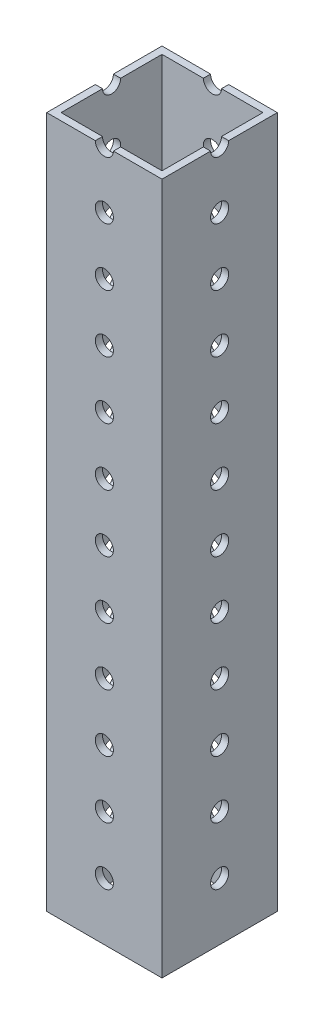
from build123d import *

# Parameters (mm, degrees)
SKETCH1_W                   = 25.4
SKETCH1_H                   = 25.4
SKETCH1_W_2                 = 22.225
SKETCH1_H_2                 = 22.225
BOSS_EXTRUDE1_DEPTH         = 152.4
F_22_0_157_DIAMETER_HOLE1_D = 3.9878
LPATTERN1_COUNT             = 12
LPATTERN1_PITCH             = 12.7
F_22_0_157_DIAMETER_HOLE2_D = 3.9878
LPATTERN2_COUNT             = 12
LPATTERN2_PITCH             = 12.7


with BuildPart() as part:
    # Sketch1 → Boss-Extrude1 (new body)
    with BuildSketch(Plane(origin=(0, 0, 0), x_dir=(1, 0, 0), z_dir=(0, 1, 0))):
        Rectangle(SKETCH1_W, SKETCH1_H)
        Rectangle(SKETCH1_W_2, SKETCH1_H_2, mode=Mode.SUBTRACT)
    extrude(amount=BOSS_EXTRUDE1_DEPTH)

    # #22 (0.157) Diameter Hole1 (through all)
    with Locations(Plane.XY.offset(12.7)):
        with Locations((0, 12.7)):
            f_22_0_157_diameter_hole1 = Hole(F_22_0_157_DIAMETER_HOLE1_D / 2)

    # LPattern1: #22 (0.157) Diameter Hole1 ×12
    with Locations(*[(0, i * LPATTERN1_PITCH, 0) for i in range(1, LPATTERN1_COUNT)]):
        add(f_22_0_157_diameter_hole1, mode=Mode.SUBTRACT)

    # #22 (0.157) Diameter Hole2 (through all)
    with Locations(Plane(origin=(12.7, 0, 0), x_dir=(0, 0, -1), z_dir=(1, 0, 0))):
        with Locations((0, 12.7)):
            f_22_0_157_diameter_hole2 = Hole(F_22_0_157_DIAMETER_HOLE2_D / 2)

    # LPattern2: #22 (0.157) Diameter Hole2 ×12
    with Locations(*[(0, i * LPATTERN2_PITCH, 0) for i in range(1, LPATTERN2_COUNT)]):
        add(f_22_0_157_diameter_hole2, mode=Mode.SUBTRACT)


solid = part.part
